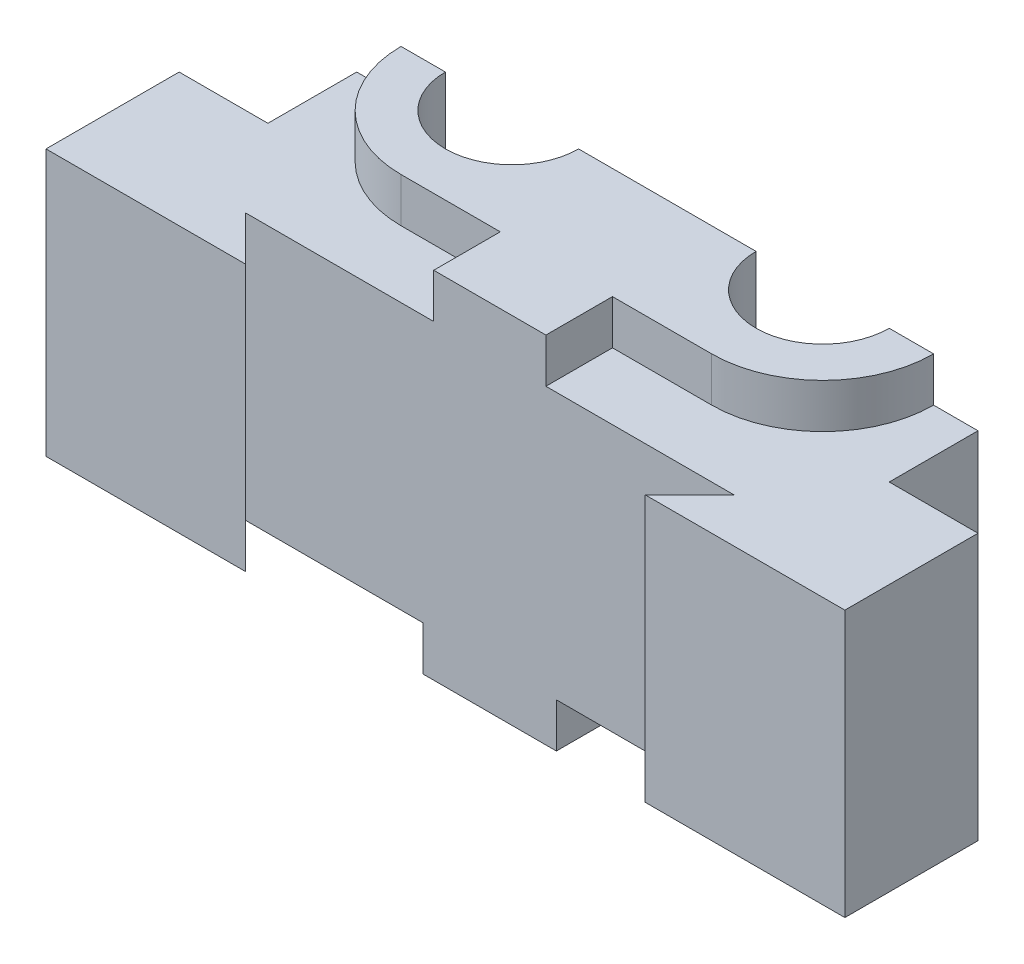
from build123d import *

# Parameters (mm, degrees)
BOSS_EXTRUDE1_DEPTH = 30
BOSS_EXTRUDE2_DEPTH = 5
BOSS_EXTRUDE3_START = 5
BOSS_EXTRUDE3_DEPTH = 5
CUT_EXTRUDE1_DEPTH  = 63.24949799
CUT_EXTRUDE2_DEPTH  = 63.24949799
SKETCH7_R           = 2.25
CUT_EXTRUDE3_DEPTH  = 15


with BuildPart() as part:
    # Sketch1 → Boss-Extrude1 (new body)
    with BuildSketch(Plane(origin=(0, 0, 0), x_dir=(1, 0, 0), z_dir=(0, 1, 0))):
        Polygon((-35, 0), (35, 0), (35, -10), (45, -10), (45, -25), (22.5, -25), (27.5, -20), (-27.5, -20), (-22.5, -25), (-45, -25), (-45, -10), (-35, -10), align=None)
    extrude(amount=BOSS_EXTRUDE1_DEPTH)

    # Sketch3 → Boss-Extrude2 (add)
    with BuildSketch(Plane(origin=(0, 30, 0), x_dir=(1, 0, 0), z_dir=(0, 1, 0))):
        with BuildLine():
            Line((-6.320139486, -12.5), (-6.320139486, -20))
            Line((-6.320139486, -20), (6.320139486, -20))
            Line((6.320139486, -20), (6.320139486, -12.5))
            Line((6.320139486, -12.5), (17.5, -12.5))
            ThreePointArc((17.5, -12.5), (26.338834765, -8.838834765), (30, 0))
            Line((30, 0), (25, 0))
            ThreePointArc((25, 0), (17.5, -7.5), (10, 0))
            Line((10, 0), (-10, 0))
            ThreePointArc((-10, 0), (-17.5, -7.5), (-25, 0))
            Line((-25, 0), (-30, 0))
            ThreePointArc((-30, 0), (-26.338834765, -8.838834765), (-17.5, -12.5))
            Line((-17.5, -12.5), (-6.320139486, -12.5))
        make_face()
    extrude(amount=BOSS_EXTRUDE2_DEPTH)

    # Sketch5 → Boss-Extrude3 (add)
    with BuildSketch(Plane.XZ.offset(BOSS_EXTRUDE3_START)):
        with BuildLine():
            Line((7.5, 20), (-7.5, 20))
            Line((-7.5, 20), (-7.5, 12.5))
            Line((-7.5, 12.5), (-17.5, 12.5))
            ThreePointArc((-17.5, 12.5), (-26.338834765, 8.838834765), (-30, 0))
            Line((-30, 0), (-25, 0))
            ThreePointArc((-25, 0), (-17.5, 7.5), (-10, 0))
            Line((-10, 0), (10, 0))
            ThreePointArc((10, 0), (17.5, 7.5), (25, 0))
            Line((25, 0), (30, 0))
            ThreePointArc((30, 0), (26.338834765, 8.838834765), (17.5, 12.5))
            Line((17.5, 12.5), (7.5, 12.5))
            Line((7.5, 12.5), (7.5, 20))
        make_face()
    extrude(amount=-BOSS_EXTRUDE3_DEPTH)

    # Sketch5<3> → Cut-Extrude1 (cut, through all)
    with BuildSketch(Plane.XZ):
        with BuildLine():
            ThreePointArc((-10, 0), (-17.5, 7.5), (-25, 0))
            Line((-25, 0), (-10, 0))
        make_face()
    extrude(amount=-CUT_EXTRUDE1_DEPTH, mode=Mode.SUBTRACT)

    # Sketch3<3> → Cut-Extrude2 (cut, through all)
    with BuildSketch(Plane(origin=(0, 30, 0), x_dir=(1, 0, 0), z_dir=(0, 1, 0))):
        with BuildLine():
            ThreePointArc((10, 0), (17.5, -7.5), (25, 0))
            Line((25, 0), (10, 0))
        make_face()
    extrude(amount=-CUT_EXTRUDE2_DEPTH, mode=Mode.SUBTRACT)

    # Sketch7 → Cut-Extrude3 (cut)
    with BuildSketch(Plane(origin=(0, 0, 0), x_dir=(-1, 0, 0), z_dir=(0, 0, -1))):
        Circle(SKETCH7_R)
        with Locations((0, 30)):
            Circle(SKETCH7_R)
        with Locations((-30, 22.5)):
            Circle(SKETCH7_R)
        with Locations((-30, 7.5)):
            Circle(SKETCH7_R)
        with Locations((30, 7.5)):
            Circle(SKETCH7_R)
        with Locations((30, 22.5)):
            Circle(SKETCH7_R)
    extrude(amount=-CUT_EXTRUDE3_DEPTH, mode=Mode.SUBTRACT)


solid = part.part
